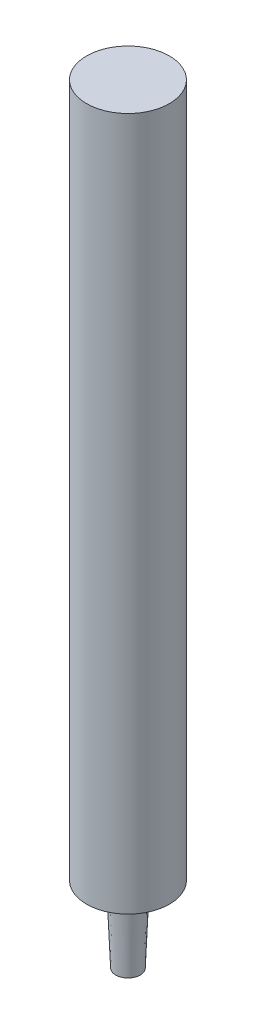
from build123d import *

# Parameters (mm, degrees)
SCALE1_SCALE_X = 1.05
SCALE1_SCALE_Y = 1.01
SCALE1_SCALE_Z = 1.05


with BuildPart() as part:
    # Sketch2 → Revolve1 (revolve)
    with BuildSketch(Plane.XY):
        Polygon((0, 60.5), (0, -60.5), (2.8, -60.5), (3.35, -46.35), (9.44, -42.5), (9.44, 60.5), (9.44, 122), (0, 122), align=None)
    revolve(axis=Axis((0, 60.5, 0), (0, -1, 0)))


with BuildPart() as part_1:
    # Scale1: scaled about (0, 0, 0)
    add(part.part.scale((SCALE1_SCALE_X, SCALE1_SCALE_Y, SCALE1_SCALE_Z), about=(0, 0, 0)))


solid = part_1.part
